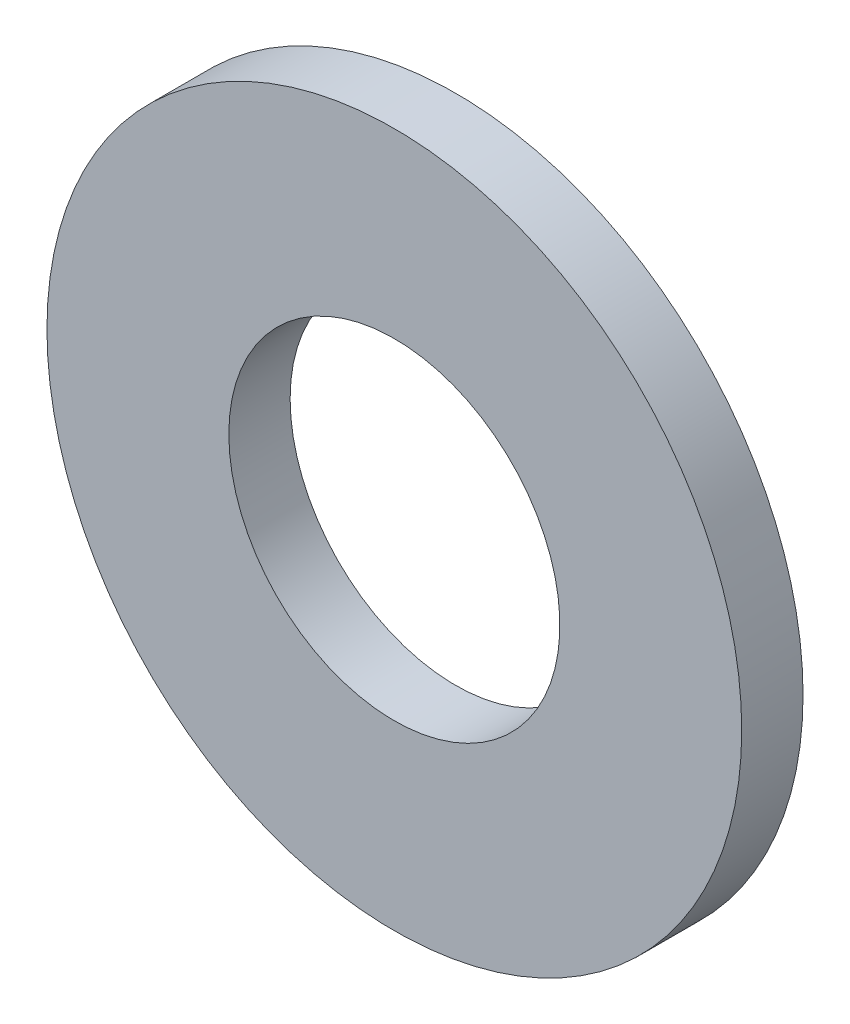
from build123d import *

# Parameters (mm, degrees)
SKETCH1_W = 1.78
SKETCH1_H = 0.6


with BuildPart() as part:
    # Sketch1 → Revolve1 (revolve)
    with BuildSketch(Plane.XZ, mode=Mode.PRIVATE) as revolve1_sk:
        with Locations((2.51, 0.3)):
            Rectangle(SKETCH1_W, SKETCH1_H)
    revolve(revolve1_sk.sketch.rotate(Axis((0, 0, 0.6), (0, 0, -1)), 180), axis=Axis((0, 0, 0.6), (0, 0, -1)))


solid = part.part
